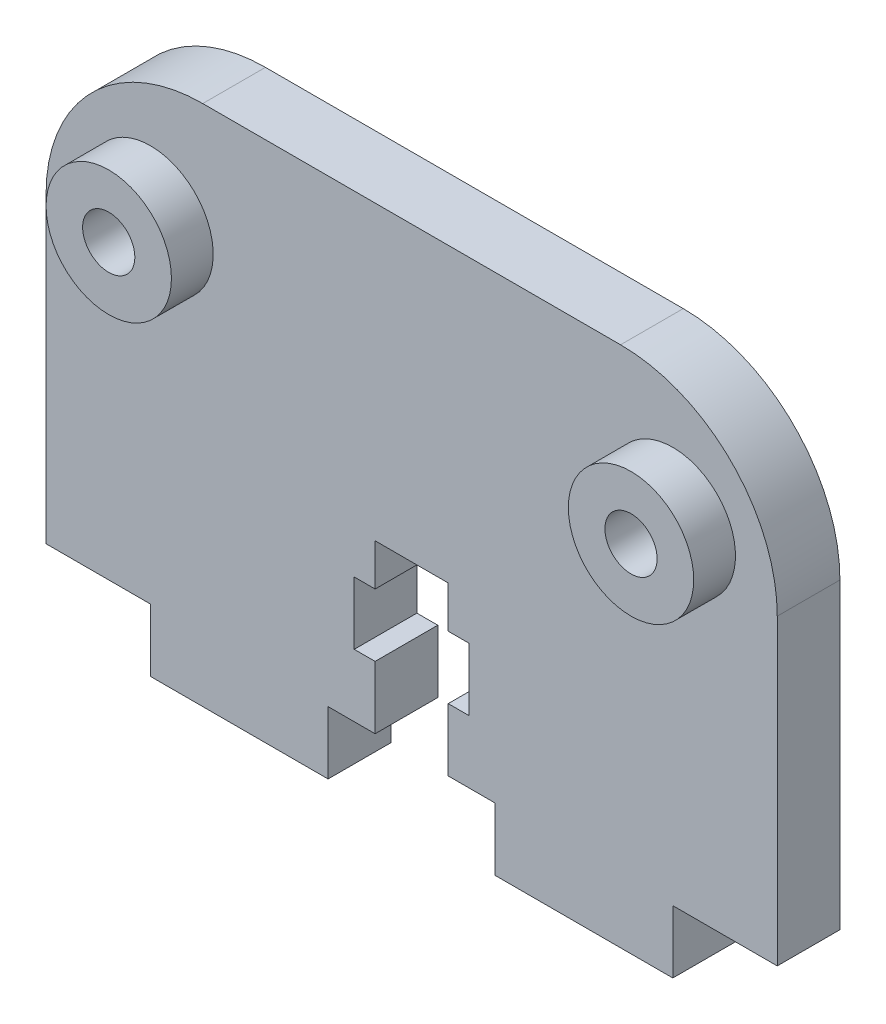
from build123d import *

# Parameters (mm, degrees)
ESQUISSE1_W              = 35
ESQUISSE1_H              = 25
BOSS_EXTRU_1_DEPTH       = 3
CONG_3_R                 = 7.5
ENL_V_MAT_EXTRU_2_REACH  = 45.116
ESQUISSE3_W              = 8
ESQUISSE3_H              = 3
ENL_V_MAT_EXTRU_3_REACH  = 45.116
ESQUISSE4_W              = 5.5
ESQUISSE4_H              = 3
ENL_V_START              = -3
ESQUISSE5_W              = 3.5
ESQUISSE5_H              = 11
ENL_V_MAT_EXTRU_4_DEPTH  = 3
ENL_V_MAT_EXTRU_7_REACH  = 45.116
ESQUISSE8_W              = 5
ESQUISSE8_H              = 3
ENL_V_MAT_EXTRU_8_REACH  = 45.116
ESQUISSE9_W              = 5
ESQUISSE9_H              = 3
ESQUISSE12_R             = 3
BOSS_EXTRU_2_DEPTH       = 2
ESQUISSE13_R             = 3
BOSS_EXTRU_4_DEPTH       = 2
ENL_V_MAT_EXTRU_11_REACH = 45.301
ESQUISSE14_R             = 1.25
ENL_V_MAT_EXTRU_12_REACH = 45.301
ESQUISSE15_R             = 1.25


with BuildPart() as part:
    # Esquisse1 → Boss.-Extru.1 (new body)
    with BuildSketch(Plane.XY):
        with Locations((17.5, 12.5)):
            Rectangle(ESQUISSE1_W, ESQUISSE1_H)
    extrude(amount=BOSS_EXTRU_1_DEPTH)

    # Congé3
    cong_3_edges = [part.edges().sort_by_distance(p)[0] for p in [
        (0, 25, 1.5),
        (35, 25, 1.5),
    ]]
    fillet(cong_3_edges, radius=CONG_3_R)

    # Esquisse3 → Enlèv. mat.-Extru.2 (cut, up to next)
    with BuildSketch(Plane.XY.offset(3), mode=Mode.PRIVATE) as enl_v_mat_extru_2_sk1:
        with Locations((17.5, 1.5)):
            Rectangle(ESQUISSE3_W, ESQUISSE3_H)
    enl_v_mat_extru_2_tool1 = extrude(enl_v_mat_extru_2_sk1.sketch, amount=-ENL_V_MAT_EXTRU_2_REACH, mode=Mode.PRIVATE) & part.part
    add(enl_v_mat_extru_2_tool1.solids().sort_by_distance((17.5, 1.5, 3))[0], mode=Mode.SUBTRACT)

    # Esquisse4 → Enlèv. mat.-Extru.3 (cut, up to next)
    with BuildSketch(Plane.XY.offset(3), mode=Mode.PRIVATE) as enl_v_mat_extru_3_sk1:
        with Locations((17.5, 7.5)):
            Rectangle(ESQUISSE4_W, ESQUISSE4_H)
    enl_v_mat_extru_3_tool1 = extrude(enl_v_mat_extru_3_sk1.sketch, amount=-ENL_V_MAT_EXTRU_3_REACH, mode=Mode.PRIVATE) & part.part
    add(enl_v_mat_extru_3_tool1.solids().sort_by_distance((17.5, 7.5, 3))[0], mode=Mode.SUBTRACT)

    # Esquisse5 → Enlèv. mat.-Extru.4 (cut)
    with BuildSketch(Plane.XY.offset(3).offset(ENL_V_START)):
        with Locations((17.5, 5.5)):
            Rectangle(ESQUISSE5_W, ESQUISSE5_H)
    extrude(amount=ENL_V_MAT_EXTRU_4_DEPTH, mode=Mode.SUBTRACT)

    # Esquisse8 → Enlèv. mat.-Extru.7 (cut, up to next)
    with BuildSketch(Plane.XY.offset(3), mode=Mode.PRIVATE) as enl_v_mat_extru_7_sk1:
        with Locations((2.5, 1.5)):
            Rectangle(ESQUISSE8_W, ESQUISSE8_H)
    enl_v_mat_extru_7_tool1 = extrude(enl_v_mat_extru_7_sk1.sketch, amount=-ENL_V_MAT_EXTRU_7_REACH, mode=Mode.PRIVATE) & part.part
    add(enl_v_mat_extru_7_tool1.solids().sort_by_distance((2.5, 1.5, 3))[0], mode=Mode.SUBTRACT)

    # Esquisse9 → Enlèv. mat.-Extru.8 (cut, up to next)
    with BuildSketch(Plane.XY.offset(3), mode=Mode.PRIVATE) as enl_v_mat_extru_8_sk1:
        with Locations((32.5, 1.5)):
            Rectangle(ESQUISSE9_W, ESQUISSE9_H)
    enl_v_mat_extru_8_tool1 = extrude(enl_v_mat_extru_8_sk1.sketch, amount=-ENL_V_MAT_EXTRU_8_REACH, mode=Mode.PRIVATE) & part.part
    add(enl_v_mat_extru_8_tool1.solids().sort_by_distance((32.5, 1.5, 3))[0], mode=Mode.SUBTRACT)

    # Esquisse12 → Boss.-Extru.2 (add)
    with BuildSketch(Plane.XY.offset(3)):
        with Locations(Location((30, 19, 0), (0, 0, 180))):
            Circle(ESQUISSE12_R)
    extrude(amount=BOSS_EXTRU_2_DEPTH)

    # Esquisse13 → Boss.-Extru.4 (add)
    with BuildSketch(Plane.XY.offset(3)):
        with Locations(Location((5, 19, 0), (0, 0, 180))):
            Circle(ESQUISSE13_R)
    extrude(amount=BOSS_EXTRU_4_DEPTH)

    # Esquisse14 → Enlèv. mat.-Extru.11 (cut, up to next)
    with BuildSketch(Plane.XY.offset(5), mode=Mode.PRIVATE) as enl_v_mat_extru_11_sk1:
        with Locations((5, 19)):
            Circle(ESQUISSE14_R)
    enl_v_mat_extru_11_tool1 = extrude(enl_v_mat_extru_11_sk1.sketch, amount=-ENL_V_MAT_EXTRU_11_REACH, mode=Mode.PRIVATE) & part.part
    add(enl_v_mat_extru_11_tool1.solids().sort_by_distance((5, 19, 5))[0], mode=Mode.SUBTRACT)

    # Esquisse15 → Enlèv. mat.-Extru.12 (cut, up to next)
    with BuildSketch(Plane.XY.offset(5), mode=Mode.PRIVATE) as enl_v_mat_extru_12_sk1:
        with Locations((30, 19)):
            Circle(ESQUISSE15_R)
    enl_v_mat_extru_12_tool1 = extrude(enl_v_mat_extru_12_sk1.sketch, amount=-ENL_V_MAT_EXTRU_12_REACH, mode=Mode.PRIVATE) & part.part
    add(enl_v_mat_extru_12_tool1.solids().sort_by_distance((30, 19, 5))[0], mode=Mode.SUBTRACT)


solid = part.part
